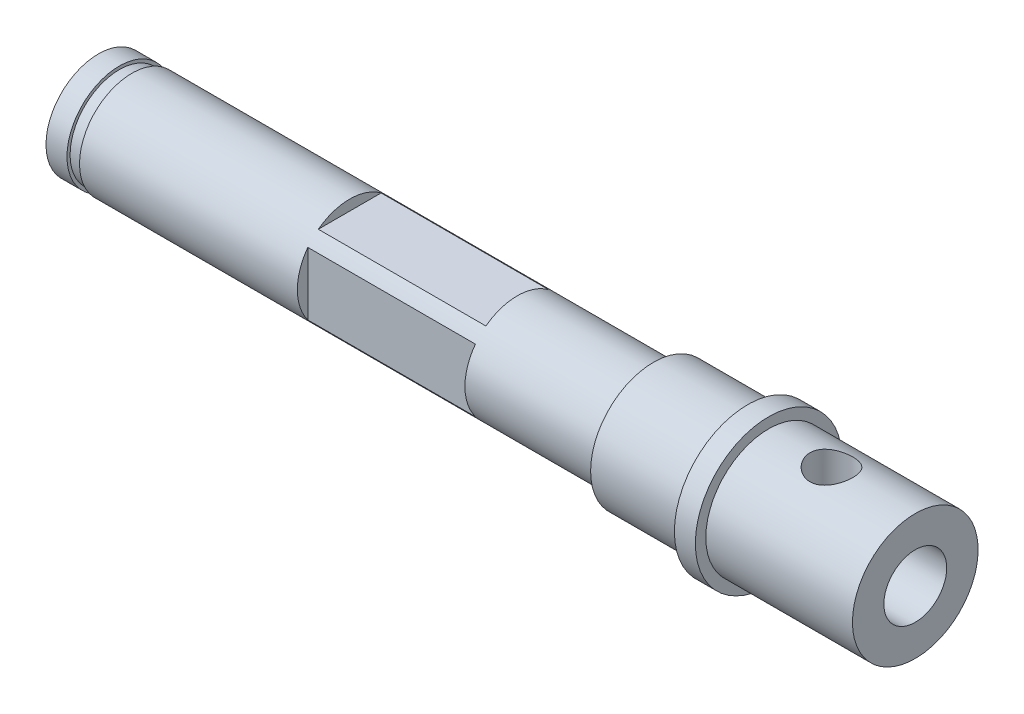
from build123d import *

# Parameters (mm, degrees)
SKETCH_2_W               = 8
SKETCH_2_H               = 5
CUT_EXTRUDE_1_DEPTH      = 0.5
SKETCH_3_W               = 8
SKETCH_3_H               = 5
CUT_EXTRUDE_2_DEPTH      = 0.5
MM_1_D                   = 3
MM_1_DEPTH               = 10
MM_1_TIP                 = 0.901290929
HOLE_WIZARD_M2_5_1_D     = 2.05
HOLE_WIZARD_M2_5_1_DEPTH = 3
HOLE_WIZARD_M2_5_1_TIP   = 0.615882135


with BuildPart() as part:
    # 草图1 → 旋转1 (revolve)
    with BuildSketch(Plane.XY, mode=Mode.PRIVATE) as revolve_1_sk:
        Polygon((0, 0), (0, 2.5), (1, 2.5), (1, 2.35), (1.6, 2.35), (1.6, 2.5), (26.5, 2.5), (26.5, 3), (31, 3), (31, 3.5), (32, 3.5), (32, 3), (39, 3), (39, 0), align=None)
    revolve(revolve_1_sk.sketch.rotate(Axis((0, 0, 0), (1, 0, 0)), 90), axis=Axis((0, 0, 0), (1, 0, 0)))

    # 草图2 → 切除-拉伸1 (cut)
    with BuildSketch(Plane.XY.offset(2.5)):
        with Locations((16, 0)):
            Rectangle(SKETCH_2_W, SKETCH_2_H)
    extrude(amount=-CUT_EXTRUDE_1_DEPTH, mode=Mode.SUBTRACT)

    # 草图3 → 切除-拉伸2 (cut)
    with BuildSketch(Plane(origin=(0, 2.5, 0), x_dir=(1, 0, 0), z_dir=(0, 1, 0))):
        with Locations((16, 0)):
            Rectangle(SKETCH_3_W, SKETCH_3_H)
    extrude(amount=-CUT_EXTRUDE_2_DEPTH, mode=Mode.SUBTRACT)

    # 大小mm 暗销孔1
    with Locations(Plane(origin=(39, 0, 0), x_dir=(0, 0, 1), z_dir=(1, 0, 0))):
        with Locations((0, 0)):
            Hole(MM_1_D / 2, depth=MM_1_DEPTH)
            with Locations((0, 0, -(MM_1_DEPTH + MM_1_TIP / 2))):  # 118° drill point
                Cone(0, MM_1_D / 2, MM_1_TIP, mode=Mode.SUBTRACT)

    # M2.5 螺纹孔1
    with Locations(Plane(origin=(35, 3, 0), x_dir=(0, 0, 1), z_dir=(0, 1, 0))):
        with Locations((0, 0)):
            Hole(HOLE_WIZARD_M2_5_1_D / 2, depth=HOLE_WIZARD_M2_5_1_DEPTH)
            with Locations((0, 0, -(HOLE_WIZARD_M2_5_1_DEPTH + HOLE_WIZARD_M2_5_1_TIP / 2))):  # 118° drill point
                Cone(0, HOLE_WIZARD_M2_5_1_D / 2, HOLE_WIZARD_M2_5_1_TIP, mode=Mode.SUBTRACT)


solid = part.part
